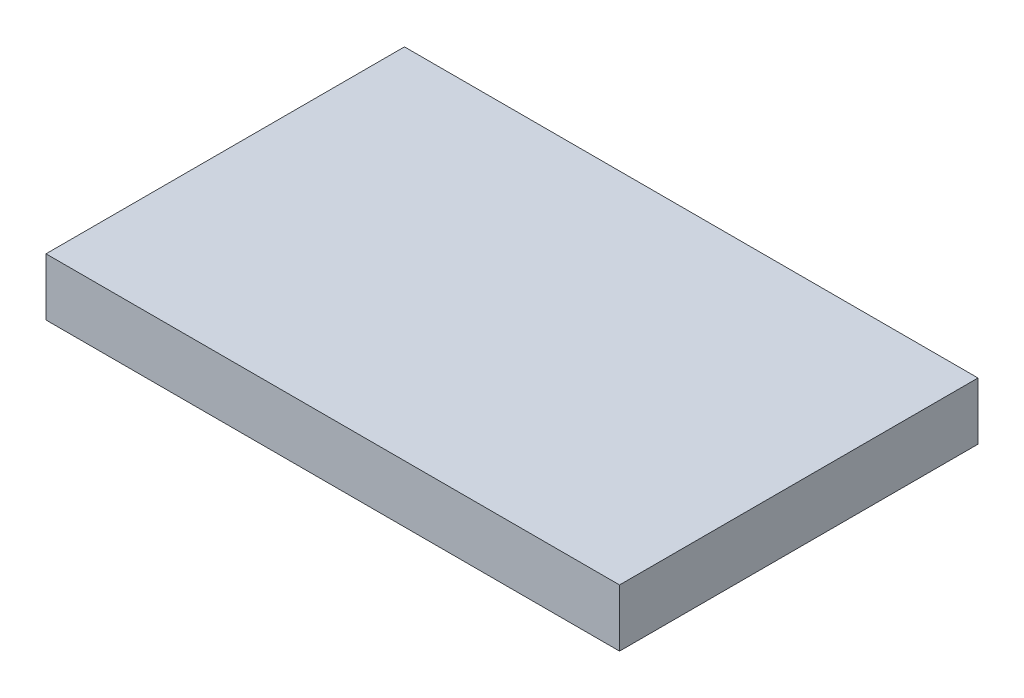
from build123d import *

# Parameters (mm, degrees)
SKETCH1_W           = 20
SKETCH1_H           = 12.5
BOSS_EXTRUDE1_DEPTH = 2


with BuildPart() as part:
    # Sketch1 → Boss-Extrude1 (new body)
    with BuildSketch(Plane(origin=(0, 0, 0), x_dir=(1, 0, 0), z_dir=(0, 1, 0))):
        with Locations((10, -6.25)):
            Rectangle(SKETCH1_W, SKETCH1_H)
    extrude(amount=BOSS_EXTRUDE1_DEPTH)


solid = part.part
